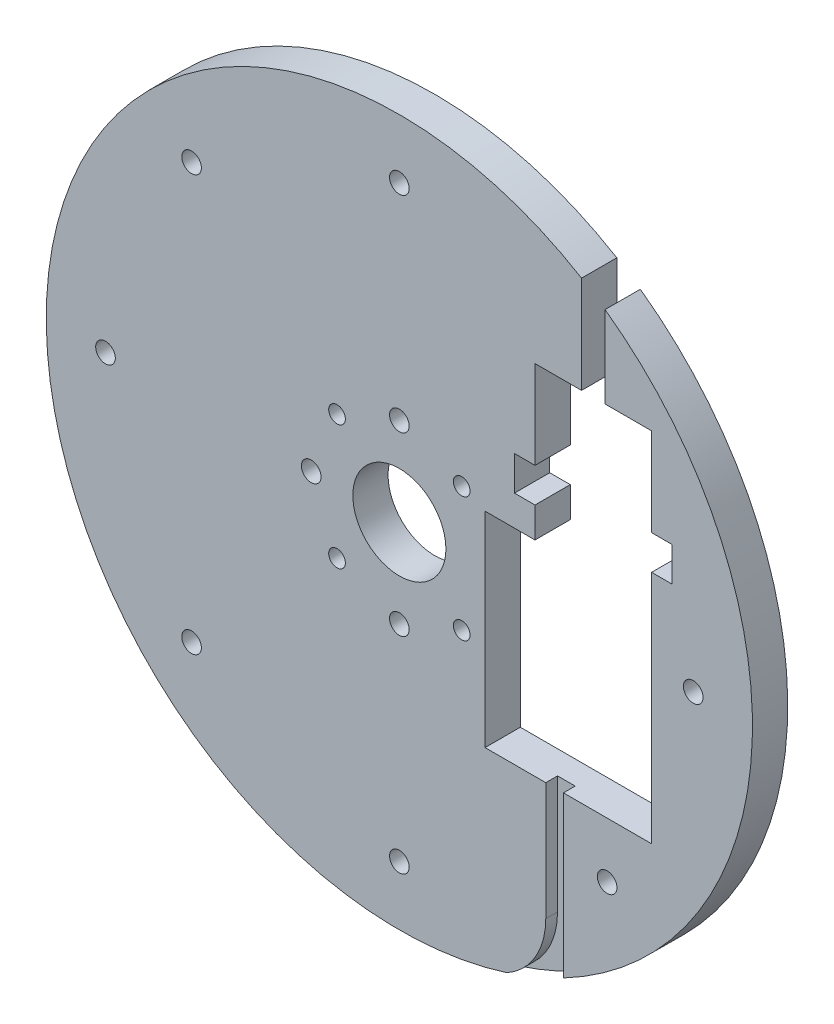
from build123d import *
from build123d.topology import SkipClean

# Parameters (mm, degrees)
SKETCH1_R           = 60
SKETCH1_R_2         = 8
SKETCH1_R_3         = 1.75
SKETCH1_R_4         = 1.5
BOSS_EXTRUDE1_DEPTH = 6
CUT_EXTRUDE1_DEPTH  = 86.064681273
MOVE_FACE1_BY       = 0.08
MOVE_FACE1_2_BY     = 0.08
MOVE_FACE1_3_BY     = 0.08
MOVE_FACE1_4_BY     = 0.08
MOVE_FACE1_5_BY     = 0.08
MOVE_FACE1_6_BY     = 0.08
MOVE_FACE1_7_BY     = 0.08
MOVE_FACE1_8_BY     = 0.08
MOVE_FACE1_9_BY     = 0.08
MOVE_FACE1_10_BY    = 0.08
MOVE_FACE1_11_BY    = 0.08
MOVE_FACE1_12_BY    = 0.08
MOVE_FACE1_13_BY    = 0.08
MOVE_FACE1_14_BY    = 0.08
MOVE_FACE1_15_BY    = 0.08
MOVE_FACE1_16_BY    = 0.08
MOVE_FACE1_17_BY    = 0.08
MOVE_FACE1_18_BY    = 0.08
MOVE_FACE1_19_BY    = 0.08
MOVE_FACE1_20_BY    = 0.08
MOVE_FACE1_21_BY    = 0.08
MOVE_FACE1_22_BY    = 0.08
MOVE_FACE1_23_BY    = 0.08
MOVE_FACE1_24_BY    = 0.08
MOVE_FACE1_25_BY    = 0.08
MOVE_FACE1_26_BY    = 0.08
MOVE_FACE1_27_BY    = 0.08
MOVE_FACE1_28_BY    = 0.08
MOVE_FACE1_29_BY    = 0.08
MOVE_FACE1_30_BY    = 0.08
CUT_EXTRUDE2_DEPTH  = 2
SKETCH4_W           = 4
SKETCH4_H           = 40
CUT_EXTRUDE3_DEPTH  = 86.177536945


with BuildPart() as part:
    # Sketch1 → Boss-Extrude1 (new body)
    with BuildSketch(Plane.XY):
        Circle(SKETCH1_R)
        Circle(SKETCH1_R_2, mode=Mode.SUBTRACT)
        with Locations((0, -15)):
            Circle(SKETCH1_R_3, mode=Mode.SUBTRACT)
        with Locations((10.606601718, -10.606601718)):
            Circle(SKETCH1_R_4, mode=Mode.SUBTRACT)
        with Locations((0, -50)):
            Circle(SKETCH1_R_3, mode=Mode.SUBTRACT)
        with Locations((-15, 0)):
            Circle(SKETCH1_R_3, mode=Mode.SUBTRACT)
        with Locations((-10.606601718, -10.606601718)):
            Circle(SKETCH1_R_4, mode=Mode.SUBTRACT)
        with Locations((0, 15)):
            Circle(SKETCH1_R_3, mode=Mode.SUBTRACT)
        with Locations((-10.606601718, 10.606601718)):
            Circle(SKETCH1_R_4, mode=Mode.SUBTRACT)
        with Locations((10.606601718, 10.606601718)):
            Circle(SKETCH1_R_4, mode=Mode.SUBTRACT)
        with Locations((-35.355339059, -35.355339059)):
            Circle(SKETCH1_R_3, mode=Mode.SUBTRACT)
        with Locations((-50, 0)):
            Circle(SKETCH1_R_3, mode=Mode.SUBTRACT)
        with Locations((-35.355339059, 35.355339059)):
            Circle(SKETCH1_R_3, mode=Mode.SUBTRACT)
        with Locations((0, 50)):
            Circle(SKETCH1_R_3, mode=Mode.SUBTRACT)
        with Locations((50, 0)):
            Circle(SKETCH1_R_3, mode=Mode.SUBTRACT)
        with Locations((35.355339059, -35.355339059)):
            Circle(SKETCH1_R_3, mode=Mode.SUBTRACT)
    extrude(amount=BOSS_EXTRUDE1_DEPTH)

    # Sketch2 → Cut-Extrude1 (cut, through all)
    with BuildSketch(Plane.XY.offset(6)):
        Polygon((14.5, -26), (43, -26), (43, 14), (46.5, 14), (46.5, 20), (43, 20), (43, 35), (23, 35), (23, 20), (19.5, 20), (19.5, 14), (23, 14), (23, 9), (14.5, 9), align=None)
    extrude(amount=-CUT_EXTRUDE1_DEPTH, mode=Mode.SUBTRACT)

    # Move Face1: a curved face moved outward by 0.08
    add(Solid.thicken(part.faces().sort_by_distance((-60, 0, 3))[0], MOVE_FACE1_BY))

    # Move Face1 2: a face moved outward by 0.08
    extrude(part.faces().sort_by_distance((23, 11.5, 3))[0], amount=MOVE_FACE1_2_BY, dir=(1, 0, 0))

    # Move Face1 3: a curved face moved outward by 0.08
    add(Solid.thicken(part.faces().sort_by_distance((-8, 0, 3))[0], MOVE_FACE1_3_BY))

    # Move Face1 4: a curved face moved outward by 0.08
    add(Solid.thicken(part.faces().sort_by_distance((-1.75, -15, 3))[0], MOVE_FACE1_4_BY))

    # Move Face1 5: a curved face moved outward by 0.08
    add(Solid.thicken(part.faces().sort_by_distance((9.106601718, -10.606601718, 3))[0], MOVE_FACE1_5_BY))

    # Move Face1 6: a curved face moved outward by 0.08
    add(Solid.thicken(part.faces().sort_by_distance((-1.75, -50, 3))[0], MOVE_FACE1_6_BY))

    # Move Face1 7: a curved face moved outward by 0.08
    add(Solid.thicken(part.faces().sort_by_distance((-16.75, 0, 3))[0], MOVE_FACE1_7_BY))

    # Move Face1 8: a curved face moved outward by 0.08
    add(Solid.thicken(part.faces().sort_by_distance((-12.106601718, -10.606601718, 3))[0], MOVE_FACE1_8_BY))

    # Move Face1 9: a curved face moved outward by 0.08
    add(Solid.thicken(part.faces().sort_by_distance((-1.75, 15, 3))[0], MOVE_FACE1_9_BY))

    # Move Face1 10: a curved face moved outward by 0.08
    add(Solid.thicken(part.faces().sort_by_distance((-12.106601718, 10.606601718, 3))[0], MOVE_FACE1_10_BY))

    # Move Face1 11: a curved face moved outward by 0.08
    add(Solid.thicken(part.faces().sort_by_distance((9.106601718, 10.606601718, 3))[0], MOVE_FACE1_11_BY))

    # Move Face1 12: a curved face moved outward by 0.08
    add(Solid.thicken(part.faces().sort_by_distance((-37.105339059, -35.355339059, 3))[0], MOVE_FACE1_12_BY))

    # Move Face1 13: a curved face moved outward by 0.08
    add(Solid.thicken(part.faces().sort_by_distance((-51.75, 0, 3))[0], MOVE_FACE1_13_BY))

    # Move Face1 14: a curved face moved outward by 0.08
    add(Solid.thicken(part.faces().sort_by_distance((-37.105339059, 35.355339059, 3))[0], MOVE_FACE1_14_BY))

    # Move Face1 15: a curved face moved outward by 0.08
    add(Solid.thicken(part.faces().sort_by_distance((-1.75, 50, 3))[0], MOVE_FACE1_15_BY))

    # Move Face1 16: a curved face moved outward by 0.08
    add(Solid.thicken(part.faces().sort_by_distance((48.25, 0, 3))[0], MOVE_FACE1_16_BY))

    # Move Face1 17: a curved face moved outward by 0.08
    add(Solid.thicken(part.faces().sort_by_distance((33.605339059, -35.355339059, 3))[0], MOVE_FACE1_17_BY))

    # Move Face1 18: a face moved outward by 0.08
    extrude(part.faces().sort_by_distance((23, 27.5, 3))[0], amount=MOVE_FACE1_18_BY, dir=(1, 0, 0))

    # Move Face1 19: a face moved outward by 0.08
    extrude(part.faces().sort_by_distance((18.75, 9, 3))[0], amount=MOVE_FACE1_19_BY, dir=(0, -1, 0))

    # Move Face1 20: a face moved outward by 0.08
    extrude(part.faces().sort_by_distance((21.25, 14, 3))[0], amount=MOVE_FACE1_20_BY, dir=(0, 1, 0))

    # Move Face1 21: a face moved outward by 0.08
    extrude(part.faces().sort_by_distance((21.25, 20, 3))[0], amount=MOVE_FACE1_21_BY, dir=(0, -1, 0))

    # Move Face1 22: a face moved outward by 0.08
    extrude(part.faces().sort_by_distance((33, 35, 3))[0], amount=MOVE_FACE1_22_BY, dir=(0, -1, 0))

    # Move Face1 23: a face moved outward by 0.08
    extrude(part.faces().sort_by_distance((28.75, -26, 3))[0], amount=MOVE_FACE1_23_BY, dir=(0, 1, 0))

    # Move Face1 24: a face moved outward by 0.08
    extrude(part.faces().sort_by_distance((43, -6, 3))[0], amount=MOVE_FACE1_24_BY, dir=(-1, 0, 0))

    # Move Face1 25: a face moved outward by 0.08
    extrude(part.faces().sort_by_distance((44.75, 14, 3))[0], amount=MOVE_FACE1_25_BY, dir=(0, 1, 0))

    # Move Face1 26: a face moved outward by 0.08
    extrude(part.faces().sort_by_distance((46.5, 17, 3))[0], amount=MOVE_FACE1_26_BY, dir=(-1, 0, 0))

    # Move Face1 27: a face moved outward by 0.08
    extrude(part.faces().sort_by_distance((44.75, 20, 3))[0], amount=MOVE_FACE1_27_BY, dir=(0, -1, 0))

    # Move Face1 28: a face moved outward by 0.08
    extrude(part.faces().sort_by_distance((43, 27.5, 3))[0], amount=MOVE_FACE1_28_BY, dir=(-1, 0, 0))

    # Move Face1 29: a face moved outward by 0.08
    extrude(part.faces().sort_by_distance((19.5, 17, 3))[0], amount=MOVE_FACE1_29_BY, dir=(1, 0, 0))

    # Move Face1 30: a face moved outward by 0.08
    extrude(part.faces().sort_by_distance((14.5, -8.5, 3))[0], amount=MOVE_FACE1_30_BY, dir=(1, 0, 0))

    # Sketch3 → Cut-Extrude2 (cut)
    with BuildSketch(Plane.XY.offset(6)):
        with BuildLine():
            Line((24.91040122, -45.959), (24.91040122, -25.92))
            Line((24.91040122, -25.92), (27.91040122, -25.92))
            Line((27.91040122, -25.92), (27.91040122, -58.86940122))
            Line((27.91040122, -58.86940122), (12, -58.86940122))
            ThreePointArc((12, -58.86940122), (21.12903225, -55.08803225), (24.91040122, -45.959))
        make_face()
    extrude(amount=-CUT_EXTRUDE2_DEPTH, mode=Mode.SUBTRACT)

    # Sketch4 → Cut-Extrude3 (cut, through all)
    with SkipClean():  # the faces are left unmerged after this step: merging them gives an invalid solid
        with BuildSketch(Plane.XY.offset(6)):
            with Locations((33, 34.92)):
                Rectangle(SKETCH4_W, SKETCH4_H)
        extrude(amount=-CUT_EXTRUDE3_DEPTH, mode=Mode.SUBTRACT)


solid = part.part
